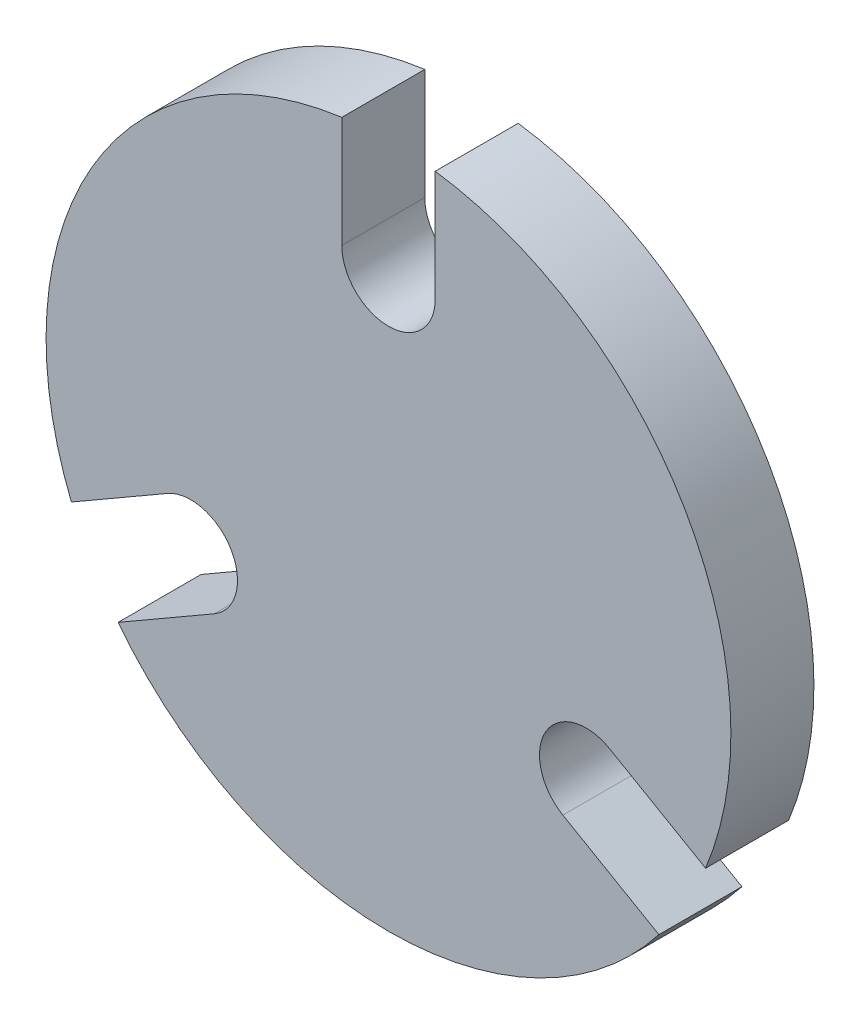
from build123d import *

# Parameters (mm, degrees)
BOSS_EXTRUDE1_DEPTH = 0.8


with BuildPart() as part:
    # Sketch2 → Boss-Extrude1 (new body)
    with BuildSketch(Plane.XY):
        with BuildLine():
            Line((-0.45, 2.2), (-0.45, 3.269174208))
            ThreePointArc((-0.45, 3.269174208), (-2.857883832, 1.65), (-3.056187913, -1.244875672))
            Line((-3.056187913, -1.244875672), (-2.130255888, -0.710288568))
            ThreePointArc((-2.130255888, -0.710288568), (-1.515544457, -0.875), (-1.680255888, -1.489711432))
            Line((-1.680255888, -1.489711432), (-2.606187913, -2.024298536))
            ThreePointArc((-2.606187913, -2.024298536), (0, -3.3), (2.606187913, -2.024298536))
            Line((2.606187913, -2.024298536), (1.680255888, -1.489711432))
            ThreePointArc((1.680255888, -1.489711432), (1.515544457, -0.875), (2.130255888, -0.710288568))
            Line((2.130255888, -0.710288568), (3.056187913, -1.244875672))
            ThreePointArc((3.056187913, -1.244875672), (2.857883832, 1.65), (0.45, 3.269174208))
            Line((0.45, 3.269174208), (0.45, 2.2))
            ThreePointArc((0.45, 2.2), (0, 1.75), (-0.45, 2.2))
        make_face()
    extrude(amount=BOSS_EXTRUDE1_DEPTH)


solid = part.part
